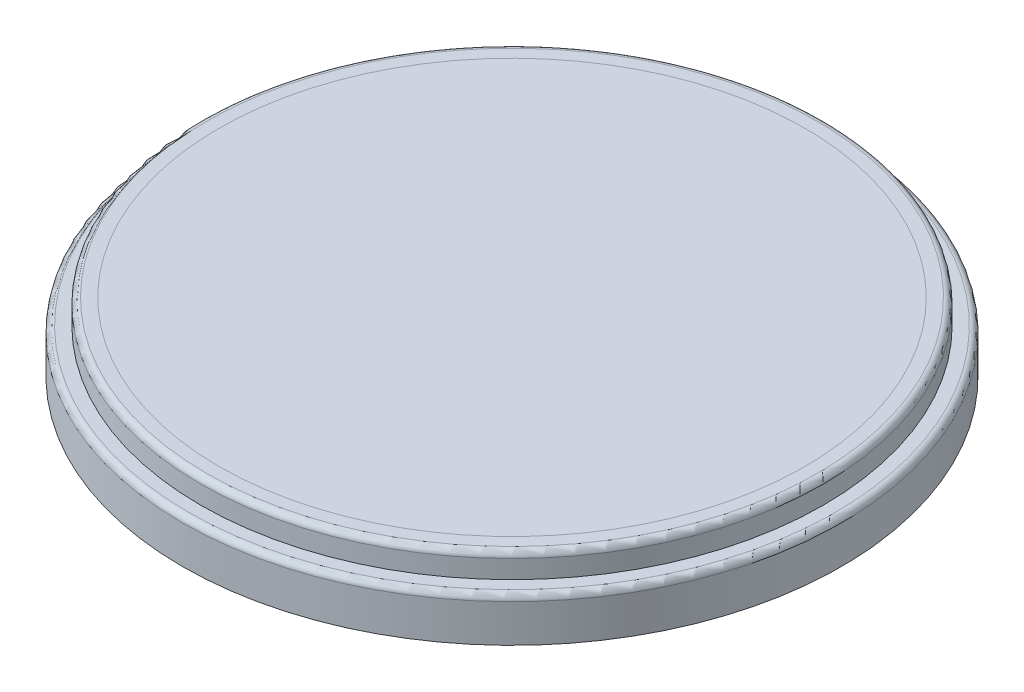
from build123d import *

# Parameters (mm, degrees)
SKETCH1_R           = 27
SKETCH1_R_2         = 25.5
BOSS_EXTRUDE1_DEPTH = 3.6
SKETCH2_R           = 25.5
SKETCH2_R_2         = 24
BOSS_EXTRUDE2_DEPTH = 2
FILLET2_R           = 0.5
FILLET4_R           = 0.5
SKETCH3_R           = 24
BOSS_EXTRUDE4_DEPTH = 1


with BuildPart() as part:
    # Sketch1 → Boss-Extrude1 (new body)
    with BuildSketch(Plane(origin=(0, 0, 0), x_dir=(1, 0, 0), z_dir=(0, 1, 0))):
        with Locations(Location((0, 0, 0), (0, 0, 270))):
            Circle(SKETCH1_R)
        with Locations(Location((0, 0, 0), (0, 0, 270))):
            Circle(SKETCH1_R_2, mode=Mode.SUBTRACT)
    extrude(amount=BOSS_EXTRUDE1_DEPTH)

    # Fillet4
    fillet4_edges = [part.edges().sort_by_distance(p)[0] for p in [
        (0, 3.6, -27),
    ]]
    fillet(fillet4_edges, radius=FILLET4_R)


with BuildPart() as body_2:
    # Sketch2 → Boss-Extrude2 (new body)
    with BuildSketch(Plane(origin=(0, 3.6, 0), x_dir=(1, 0, 0), z_dir=(0, 1, 0))):
        with Locations(Location((0, 0, 0), (0, 0, 270))):
            Circle(SKETCH2_R)
        with Locations(Location((0, 0, 0), (0, 0, 270))):
            Circle(SKETCH2_R_2, mode=Mode.SUBTRACT)
    extrude(amount=BOSS_EXTRUDE2_DEPTH)

    # Fillet2
    fillet2_edges = [body_2.edges().sort_by_distance(p)[0] for p in [
        (0, 5.6, -25.5),
        (0, 3.6, -24),
    ]]
    fillet(fillet2_edges, radius=FILLET2_R)


with BuildPart() as body_3:
    # Sketch3 → Boss-Extrude4 (new body)
    with BuildSketch(Plane(origin=(0, 5.6, 0), x_dir=(1, 0, 0), z_dir=(0, 1, 0))):
        with Locations(Location((0, 0, 0), (0, 0, 270))):
            Circle(SKETCH3_R)
    extrude(amount=-BOSS_EXTRUDE4_DEPTH)


solid = Compound([part.part, body_2.part, body_3.part])
